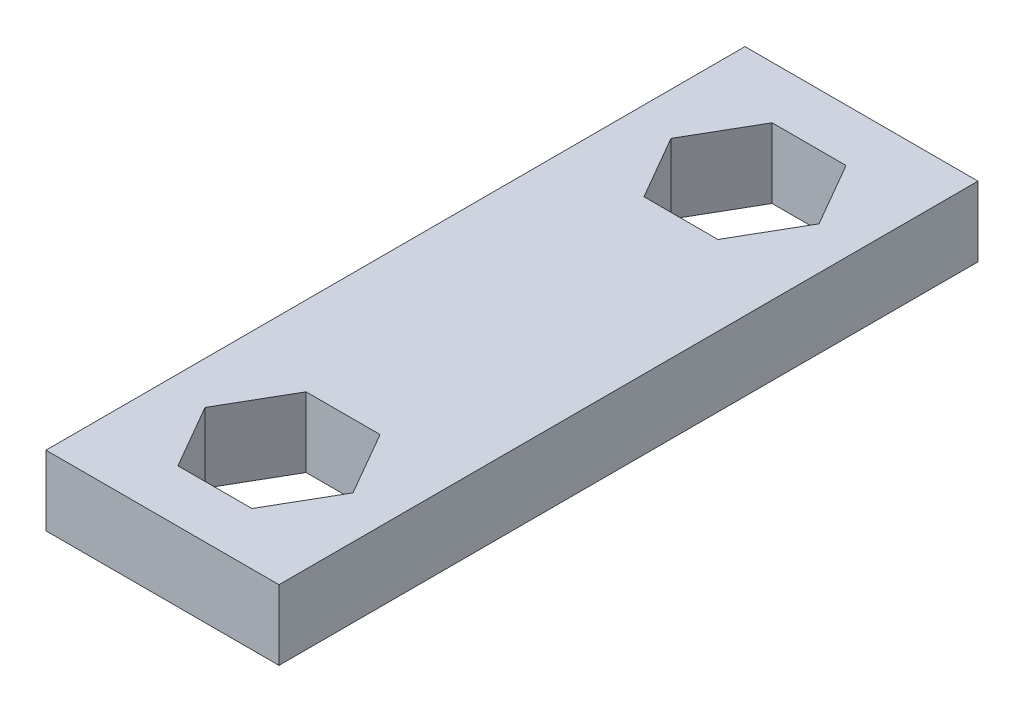
from build123d import *

# Parameters (mm, degrees)
SKETCH1_W           = 10
SKETCH1_H           = 30
BOSS_EXTRUDE1_DEPTH = 3


with BuildPart() as part:
    # Sketch1 → Boss-Extrude1 (new body)
    with BuildSketch(Plane(origin=(0, 0, 0), x_dir=(1, 0, 0), z_dir=(0, 1, 0))):
        with Locations((5, 15)):
            Rectangle(SKETCH1_W, SKETCH1_H)
        Polygon((1.824573519, 25), (3.41228676, 22.25), (6.58771324, 22.25), (8.175426481, 25), (6.58771324, 27.75), (3.41228676, 27.75), align=None, mode=Mode.SUBTRACT)
        Polygon((1.824573519, 5), (3.41228676, 7.75), (6.58771324, 7.75), (8.175426481, 5), (6.58771324, 2.25), (3.41228676, 2.25), align=None, mode=Mode.SUBTRACT)
    extrude(amount=BOSS_EXTRUDE1_DEPTH)


solid = part.part
